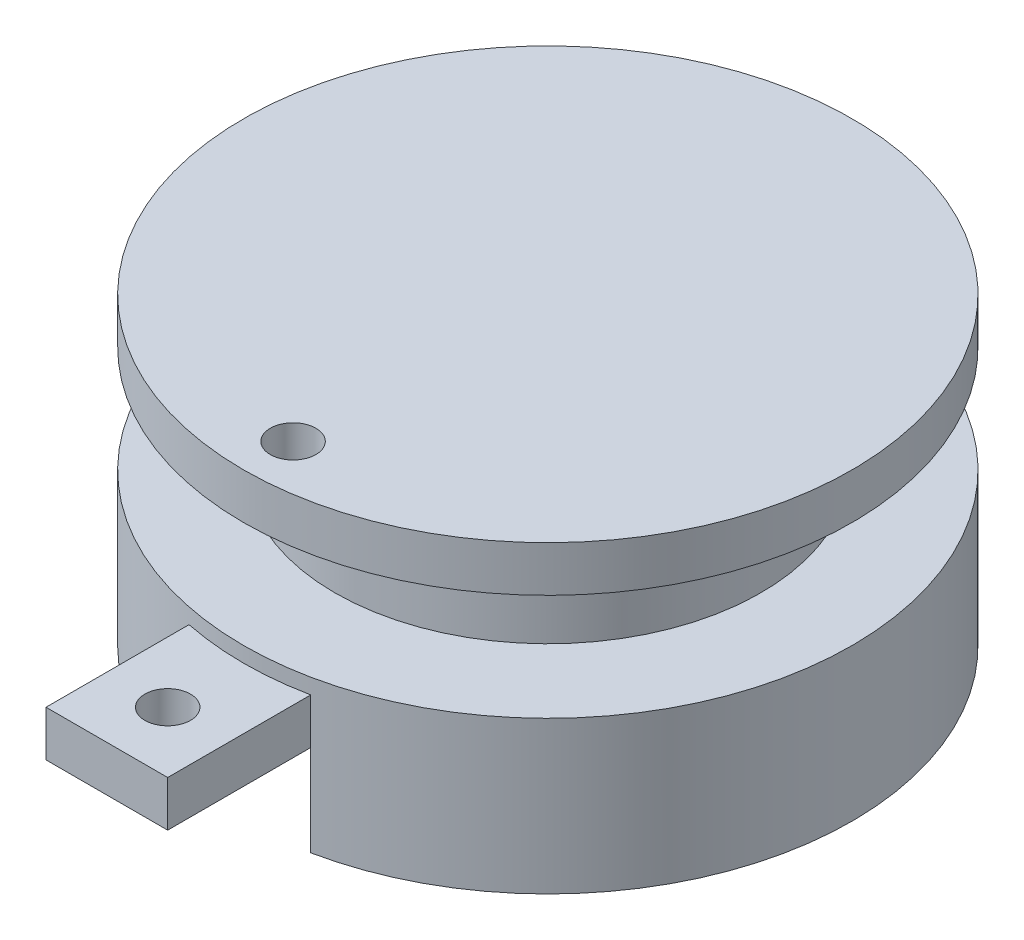
from build123d import *

# Parameters (mm, degrees)
SKETCH1_R                = 20
BOSS_EXTRUDE1_DEPTH      = 10.002293384
CUT_EXTRUDE1_DEPTH       = 6
SKETCH3_R                = 14
BOSS_EXTRUDE5_DEPTH      = 10
BOSS_EXTRUDE6_START      = -3
SKETCH11_R               = 20
BOSS_EXTRUDE6_DEPTH      = 3
SKETCH12_R               = 1.5
CUT_EXTRUDE3_DEPTH       = 3
BOSS_EXTRUDE7_DEPTH      = 9
BOSS_EXTRUDE7_DEPTH_BACK = 1
SKETCH16_W               = 8
SKETCH16_H               = 3
SKETCH17_R               = 1.5
CUT_EXTRUDE4_DEPTH       = 14
SKETCH19_R               = 3.5
CUT_EXTRUDE5_DEPTH       = 2


with BuildPart() as part:
    # Sketch1 → Boss-Extrude1 (new body)
    with BuildSketch(Plane(origin=(0, 0, 0), x_dir=(1, 0, 0), z_dir=(0, 1, 0))):
        with Locations(Location((0, 0, 0), (0, 0, 270))):
            Circle(SKETCH1_R)
    extrude(amount=BOSS_EXTRUDE1_DEPTH)

    # Sketch2 → Cut-Extrude1 (cut)
    with BuildSketch(Plane.XZ):
        with BuildLine():
            Line((-5.206856182, 6.073602613), (-4, 8.263379135))
            Line((-4, 8.263379135), (-4, 16.962161825))
            Line((-4, 16.962161825), (-4, 25.851196476))
            Line((-4, 25.851196476), (4, 25.851196476))
            Line((4, 25.851196476), (4, 16.962161825))
            Line((4, 16.962161825), (4, 8.263379135))
            Line((4, 8.263379135), (5.206856182, 6.073602613))
            ThreePointArc((5.206856182, 6.073602613), (0, -8), (-5.206856182, 6.073602613))
        make_face()
    extrude(amount=-CUT_EXTRUDE1_DEPTH, mode=Mode.SUBTRACT)

    # Sketch3 → Boss-Extrude5 (add)
    with BuildSketch(Plane(origin=(0, 10.002293384, 0), x_dir=(1, 0, 0), z_dir=(0, 1, 0))):
        with Locations(Location((0, 0, 0), (0, 0, 270))):
            Circle(SKETCH3_R)
    extrude(amount=BOSS_EXTRUDE5_DEPTH)

    # Sketch11 → Boss-Extrude6 (add)
    with BuildSketch(Plane(origin=(0, 20.002293384, 0), x_dir=(1, 0, 0), z_dir=(0, 1, 0)).offset(BOSS_EXTRUDE6_START)):
        with Locations(Location((0, 0, 0), (0, 0, 258.463040967))):
            Circle(SKETCH11_R)
    extrude(amount=BOSS_EXTRUDE6_DEPTH)

    # Sketch12 → Cut-Extrude3 (cut)
    with BuildSketch(Plane(origin=(0, 20.002293384, 0), x_dir=(1, 0, 0), z_dir=(0, 1, 0))):
        with Locations(Location((0, -16.75, 0), (0, 0, 270))):
            Circle(SKETCH12_R)
    extrude(amount=-CUT_EXTRUDE3_DEPTH, mode=Mode.SUBTRACT)

    # Sketch16 → Boss-Extrude7 (add, two sides: drawn at the far end of the back side and taken through both)
    with BuildSketch(Plane.XY.offset(20).offset(-BOSS_EXTRUDE7_DEPTH_BACK)):
        with Locations((0.006857521, 7.495030359)):
            Rectangle(SKETCH16_W, SKETCH16_H)
    extrude(amount=BOSS_EXTRUDE7_DEPTH + BOSS_EXTRUDE7_DEPTH_BACK)

    # Sketch17 → Cut-Extrude4 (cut)
    with BuildSketch(Plane(origin=(0, 8.995030359, 0), x_dir=(1, 0, 0), z_dir=(0, 1, 0))):
        with Locations(Location((0.006857521, -24.999998773, 0), (0, 0, 270))):
            Circle(SKETCH17_R)
    extrude(amount=-CUT_EXTRUDE4_DEPTH, mode=Mode.SUBTRACT)

    # Sketch19 → Cut-Extrude5 (cut)
    with BuildSketch(Plane.XZ.offset(-6)):
        with Locations(Location((0, 0, 0), (0, 0, 270))):
            Circle(SKETCH19_R)
    extrude(amount=-CUT_EXTRUDE5_DEPTH, mode=Mode.SUBTRACT)


solid = part.part
